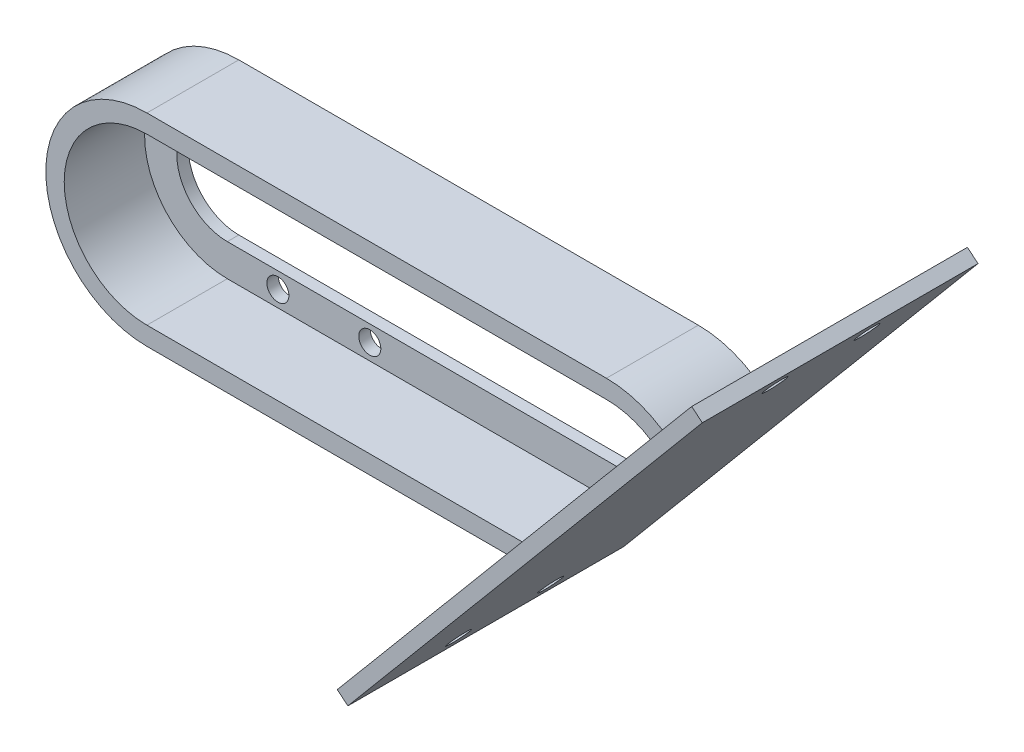
from build123d import *

# Parameters (mm, degrees)
SKETCH1_R           = 2.4
BOSS_EXTRUDE1_DEPTH = 2.5
BOSS_EXTRUDE2_DEPTH = 20
BOSS_EXTRUDE3_DEPTH = 40
BOSS_EXTRUDE4_START = -20
BOSS_EXTRUDE4_DEPTH = 20
CUT_EXTRUDE1_DEPTH  = 3


with BuildPart() as part:
    # Sketch1 → Boss-Extrude1 (new body)
    with BuildSketch(Plane.XY):
        with BuildLine():
            ThreePointArc((-21, -11), (-32, 0), (-21, 11))
            Line((-21, 11), (79, 11))
            ThreePointArc((79, 11), (82.762221577, 10.336618829), (86.070663707, 8.426488874))
            Line((86.070663707, 8.426488874), (90.570176974, 13.788799976))
            ThreePointArc((90.570176974, 13.788799976), (85.15636258, 16.914467174), (79, 18))
            Line((79, 18), (-21, 18))
            ThreePointArc((-21, 18), (-39, 0), (-21, -18))
            Line((-21, -18), (63.896206639, -18))
            Line((63.896206639, -18), (69.769904057, -11))
            Line((69.769904057, -11), (-21, -11))
        make_face()
        with Locations((10, -14.5)):
            Circle(SKETCH1_R, mode=Mode.SUBTRACT)
        with Locations((-10, -14.5)):
            Circle(SKETCH1_R, mode=Mode.SUBTRACT)
        with Locations((10, 14.5)):
            Circle(SKETCH1_R, mode=Mode.SUBTRACT)
        with Locations((-10, 14.5)):
            Circle(SKETCH1_R, mode=Mode.SUBTRACT)
    extrude(amount=BOSS_EXTRUDE1_DEPTH)

    # Sketch1<3> → Boss-Extrude2 (add)
    with BuildSketch(Plane.XY):
        with BuildLine():
            ThreePointArc((79, 18), (85.15636258, 16.914467174), (90.570176974, 13.788799976))
            Line((90.570176974, 13.788799976), (93.141327413, 16.852977749))
            ThreePointArc((93.141327413, 16.852977749), (86.524443153, 20.673237657), (79, 22))
            Line((79, 22), (-21, 22))
            ThreePointArc((-21, 22), (-43, 0), (-21, -22))
            Line((-21, -22), (60.539808114, -22))
            Line((60.539808114, -22), (63.896206639, -18))
            Line((63.896206639, -18), (-21, -18))
            ThreePointArc((-21, -18), (-39, 0), (-21, 18))
            Line((-21, 18), (79, 18))
        make_face()
    extrude(amount=BOSS_EXTRUDE2_DEPTH)

    # Sketch1<4> → Boss-Extrude3 (add)
    with BuildSketch(Plane.XY):
        with BuildLine():
            Line((86.070663707, 8.426488874), (79, 0))
            Line((79, 0), (69.769904057, -11))
            Line((69.769904057, -11), (73.686125925, -11))
            Line((73.686125925, -11), (88.100757974, 6.17868953))
            ThreePointArc((88.100757974, 6.17868953), (87.163447205, 7.372796602), (86.070663707, 8.426488874))
        make_face()
        with BuildLine():
            Line((90.570176974, 13.788799976), (86.070663707, 8.426488874))
            ThreePointArc((86.070663707, 8.426488874), (87.163447205, 7.372796602), (88.100757974, 6.17868953))
            Line((88.100757974, 6.17868953), (92.706481677, 11.6675773))
            ThreePointArc((92.706481677, 11.6675773), (91.682754612, 12.772929791), (90.570176974, 13.788799976))
        make_face()
        with BuildLine():
            Line((93.141327413, 16.852977749), (90.570176974, 13.788799976))
            ThreePointArc((90.570176974, 13.788799976), (91.682754612, 12.772929791), (92.706481677, 11.6675773))
            Line((92.706481677, 11.6675773), (95.307364493, 14.76718874))
            ThreePointArc((95.307364493, 14.76718874), (94.260024202, 15.847134168), (93.141327413, 16.852977749))
        make_face()
        with BuildLine():
            Line((117.567256581, 45.962666587), (93.141327413, 16.852977749))
            ThreePointArc((93.141327413, 16.852977749), (94.260024202, 15.847134168), (95.307364493, 14.76718874))
            Line((95.307364493, 14.76718874), (119.865389911, 44.034303758))
            Line((119.865389911, 44.034303758), (117.567256581, 45.962666587))
        make_face()
        Polygon((64.456029982, -22), (60.539808114, -22), (40.432743419, -45.962666587), (42.730876748, -47.891029416), align=None)
        Polygon((67.812428507, -18), (63.896206639, -18), (60.539808114, -22), (64.456029982, -22), align=None)
        Polygon((73.686125925, -11), (69.769904057, -11), (63.896206639, -18), (67.812428507, -18), align=None)
    extrude(amount=BOSS_EXTRUDE3_DEPTH)

    # Sketch1<5> → Boss-Extrude4 (add)
    with BuildSketch(Plane.XY.offset(BOSS_EXTRUDE4_START)):
        Polygon((64.456029982, -22), (60.539808114, -22), (40.432743419, -45.962666587), (42.730876748, -47.891029416), align=None)
        with BuildLine():
            Line((117.567256581, 45.962666587), (93.141327413, 16.852977749))
            ThreePointArc((93.141327413, 16.852977749), (94.260024202, 15.847134168), (95.307364493, 14.76718874))
            Line((95.307364493, 14.76718874), (119.865389911, 44.034303758))
            Line((119.865389911, 44.034303758), (117.567256581, 45.962666587))
        make_face()
        with BuildLine():
            Line((90.570176974, 13.788799976), (86.070663707, 8.426488874))
            ThreePointArc((86.070663707, 8.426488874), (87.163447205, 7.372796602), (88.100757974, 6.17868953))
            Line((88.100757974, 6.17868953), (92.706481677, 11.6675773))
            ThreePointArc((92.706481677, 11.6675773), (91.682754612, 12.772929791), (90.570176974, 13.788799976))
        make_face()
        with BuildLine():
            Line((93.141327413, 16.852977749), (90.570176974, 13.788799976))
            ThreePointArc((90.570176974, 13.788799976), (91.682754612, 12.772929791), (92.706481677, 11.6675773))
            Line((92.706481677, 11.6675773), (95.307364493, 14.76718874))
            ThreePointArc((95.307364493, 14.76718874), (94.260024202, 15.847134168), (93.141327413, 16.852977749))
        make_face()
        with BuildLine():
            Line((86.070663707, 8.426488874), (79, 0))
            Line((79, 0), (69.769904057, -11))
            Line((69.769904057, -11), (73.686125925, -11))
            Line((73.686125925, -11), (88.100757974, 6.17868953))
            ThreePointArc((88.100757974, 6.17868953), (87.163447205, 7.372796602), (86.070663707, 8.426488874))
        make_face()
        Polygon((73.686125925, -11), (69.769904057, -11), (63.896206639, -18), (67.812428507, -18), align=None)
        Polygon((67.812428507, -18), (63.896206639, -18), (60.539808114, -22), (64.456029982, -22), align=None)
    extrude(amount=BOSS_EXTRUDE4_DEPTH)

    # Sketch5 → Cut-Extrude1 (cut)
    with BuildSketch(Plane(origin=(48.657236347, -40.828269073, 0), x_dir=(0, 0, -1), z_dir=(0.7660444431189747, -0.6427876096865435, 0))):
        with BuildLine():
            ThreePointArc((-17.6, -2.819778835), (-20, -0.419778835), (-22.4, -2.819778835))
            Line((-22.4, -2.819778835), (-20, -2.819778835))
            Line((-20, -2.819778835), (-20, -5.219778835))
            ThreePointArc((-20, -5.219778835), (-18.302943725, -4.51683511), (-17.6, -2.819778835))
        make_face()
        with BuildLine():
            Line((-20, -2.819778835), (-22.4, -2.819778835))
            ThreePointArc((-22.4, -2.819778835), (-21.697056275, -4.51683511), (-20, -5.219778835))
            Line((-20, -5.219778835), (-20, -2.819778835))
        make_face()
        with BuildLine():
            Line((0, -5.219778835), (0, -2.819778835))
            Line((0, -2.819778835), (2.4, -2.819778835))
            ThreePointArc((2.4, -2.819778835), (-1.697056275, -1.12272256), (0, -5.219778835))
        make_face()
        with BuildLine():
            Line((2.4, -2.819778835), (0, -2.819778835))
            Line((0, -2.819778835), (0, -5.219778835))
            ThreePointArc((0, -5.219778835), (1.697056275, -4.51683511), (2.4, -2.819778835))
        make_face()
        with BuildLine():
            ThreePointArc((-17.6, 104.380221165), (-18.302943725, 106.07727744), (-20, 106.780221165))
            Line((-20, 106.780221165), (-20, 104.380221165))
            Line((-20, 104.380221165), (-22.4, 104.380221165))
            ThreePointArc((-22.4, 104.380221165), (-20, 101.980221165), (-17.6, 104.380221165))
        make_face()
        with BuildLine():
            Line((-20, 104.380221165), (-20, 106.780221165))
            ThreePointArc((-20, 106.780221165), (-21.697056275, 106.07727744), (-22.4, 104.380221165))
            Line((-22.4, 104.380221165), (-20, 104.380221165))
        make_face()
        with BuildLine():
            ThreePointArc((2.4, 104.380221165), (1.697056275, 106.07727744), (0, 106.780221165))
            Line((0, 106.780221165), (0, 104.380221165))
            Line((0, 104.380221165), (2.4, 104.380221165))
        make_face()
        with BuildLine():
            Line((0, 104.380221165), (0, 106.780221165))
            ThreePointArc((0, 106.780221165), (-1.697056275, 102.68316489), (2.4, 104.380221165))
            Line((2.4, 104.380221165), (0, 104.380221165))
        make_face()
    extrude(amount=-CUT_EXTRUDE1_DEPTH, mode=Mode.SUBTRACT)


solid = part.part
